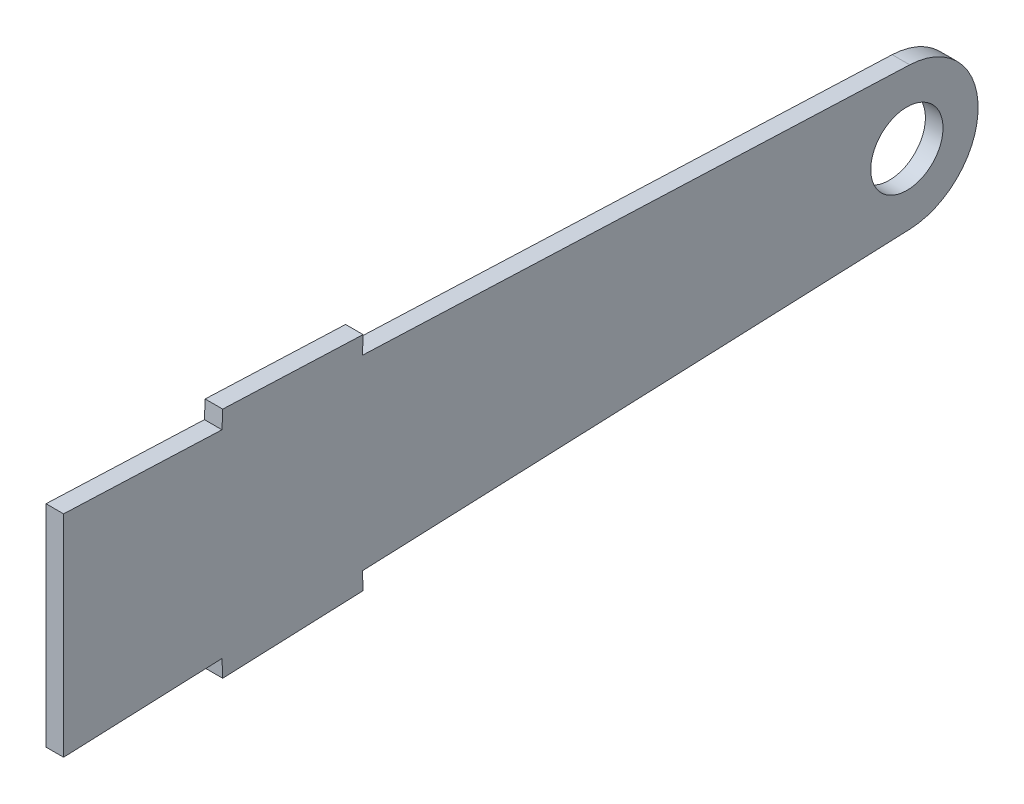
from build123d import *

# Parameters (mm, degrees)
SKETCH1_R           = 3.2639
BOSS_EXTRUDE1_DEPTH = 0.79375
BOSS_EXTRUDE2_DEPTH = 1.5875


with BuildPart() as part:
    # Sketch1 → Boss-Extrude1 (new, symmetric)
    with BuildSketch(Plane(origin=(0, 0, 0), x_dir=(0, 0, -1), z_dir=(1, 0, 0))):
        with BuildLine():
            Line((-76.2, 9.525), (-76.2, -9.525))
            Line((-76.2, -9.525), (0.260118416, -6.433643728))
            ThreePointArc((0.260118416, -6.433643728), (6.4389, 0), (0.260118416, 6.433643728))
            Line((0.260118416, 6.433643728), (-76.2, 9.525))
        make_face()
        Circle(SKETCH1_R, mode=Mode.SUBTRACT)
    extrude(amount=BOSS_EXTRUDE1_DEPTH, both=True)

    # Sketch2 → Boss-Extrude2 (add)
    with BuildSketch(Plane.ZY.offset(0.79375)):
        Polygon((61.8850913, -8.946234446), (49.1954587, -8.433180371), (49.131326941, -10.019384446), (61.82095954, -10.532438521), align=None)
        Polygon((49.131326941, 10.019384446), (49.1954587, 8.433180371), (61.8850913, 8.946234446), (61.82095954, 10.532438521), align=None)
    extrude(amount=-BOSS_EXTRUDE2_DEPTH)


solid = part.part
